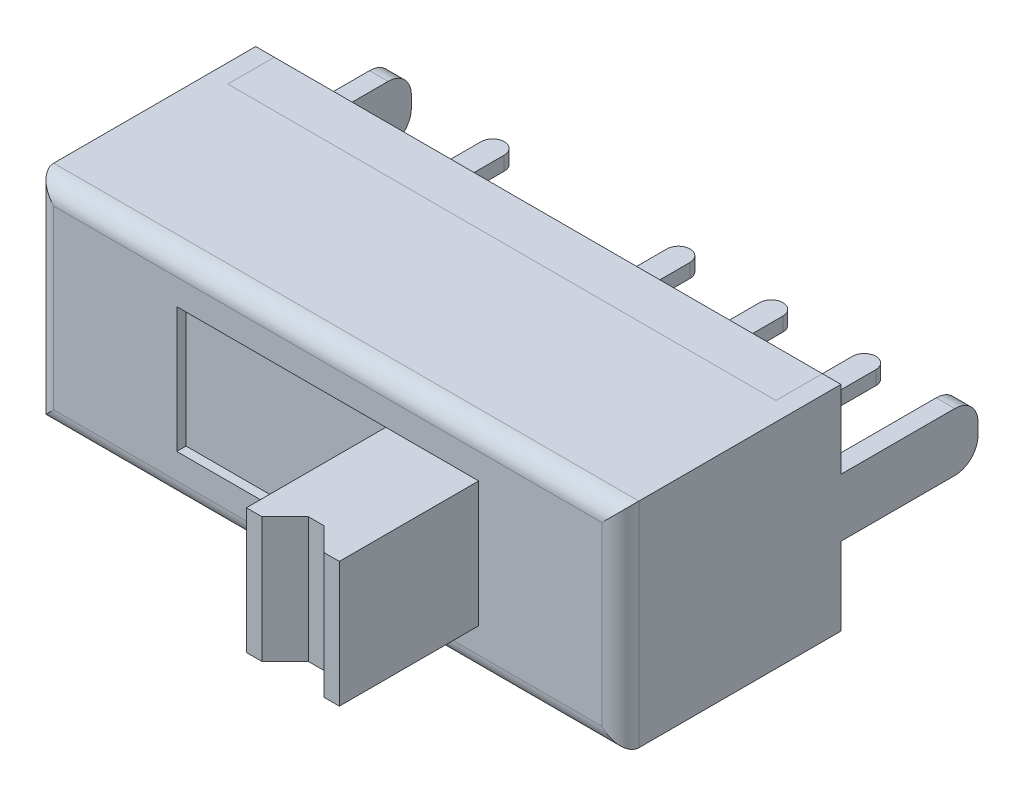
from build123d import *

# Parameters (mm, degrees)
SKETCH1_W                         = 12.6
SKETCH1_H                         = 4.6
BOSS_EXTRUDE1_DEPTH               = 4.75
FILLET2_R                         = 0.4
SKETCH2_W                         = 6.5
SKETCH2_H                         = 2.7
CUT_EXTRUDE1_DEPTH                = 0.2
BOSS_EXTRUDE2_DEPTH               = 2.7
SKETCH8_W                         = 11.8
SKETCH8_H                         = 4.6
CUT_EXTRUDE2_DEPTH                = 1
SKETCH5_W                         = 0.4
SKETCH5_H                         = 1.25
BOSS_EXTRUDE3_DEPTH               = 2.95
FILLET3_R                         = 0.5
FILLET3_OF_MIRROR1_R              = 0.5
SKETCH10_W                        = 0.5
SKETCH10_H                        = 0.3
BOSS_EXTRUDE6_DEPTH               = 4.05
FILLET5_RADIUS                    = 0.25
FILLET5_LENGTH                    = 0.3
LPATTERN3_COUNT                   = 3
LPATTERN3_PITCH                   = 2
FILLET5_OF_LPATTERN3_2_RADIUS     = 0.25
FILLET5_OF_LPATTERN3_2_LENGTH     = 0.3
FILLET5_OF_LPATTERN3_3_RADIUS     = 0.25
FILLET5_OF_LPATTERN3_3_LENGTH     = 0.3
LPATTERN3_COL_COUNT               = 2
LPATTERN3_COL_PITCH               = 4
FILLET5_OF_LPATTERN3_COL_2_RADIUS = 0.25
FILLET5_OF_LPATTERN3_COL_2_LENGTH = 0.3
SKETCH9_W                         = 11.8
SKETCH9_H                         = 4.6
BOSS_EXTRUDE7_DEPTH               = 1


with BuildPart() as part:
    # Sketch1 → Boss-Extrude1 (new body)
    with BuildSketch(Plane.XY):
        Rectangle(SKETCH1_W, SKETCH1_H)
    extrude(amount=BOSS_EXTRUDE1_DEPTH)

    # Fillet2
    fillet2_edges = [part.edges().sort_by_distance(p)[0] for p in [
        (-6.3, 0, 4.75),
        (0, -2.3, 4.75),
        (6.3, 0, 4.75),
        (0, 2.3, 4.75),
    ]]
    fillet(fillet2_edges, radius=FILLET2_R)

    # Sketch2 → Cut-Extrude1 (cut)
    with BuildSketch(Plane.XY.offset(4.75)):
        Rectangle(SKETCH2_W, SKETCH2_H)
    extrude(amount=-CUT_EXTRUDE1_DEPTH, mode=Mode.SUBTRACT)

    # Sketch4 → Boss-Extrude2 (add)
    with BuildSketch(Plane(origin=(0, -1.35, 0), x_dir=(1, 0, 0), z_dir=(0, 1, 0))):
        Polygon((3.25, -4.55), (3.25, -7.75), (2.916666667, -7.75), (2.416666667, -7.25), (2.083333333, -7.25), (1.583333333, -7.75), (1.25, -7.75), (1.25, -4.55), align=None)
    extrude(amount=BOSS_EXTRUDE2_DEPTH)

    # Sketch8 → Cut-Extrude2 (cut)
    with BuildSketch(Plane(origin=(0, 0, 0), x_dir=(-1, 0, 0), z_dir=(0, 0, -1))):
        Rectangle(SKETCH8_W, SKETCH8_H)
    extrude(amount=-CUT_EXTRUDE2_DEPTH, mode=Mode.SUBTRACT)

    # Sketch5 → Boss-Extrude3 (add)
    with BuildSketch(Plane(origin=(0, 0, 0), x_dir=(-1, 0, 0), z_dir=(0, 0, -1))):
        with Locations((-6.1, 0)):
            Rectangle(SKETCH5_W, SKETCH5_H)
    boss_extrude3 = extrude(amount=BOSS_EXTRUDE3_DEPTH)

    # Fillet3
    fillet3_edges = [part.edges().sort_by_distance(p)[0] for p in [
        (6.1, 0.625, -2.95),
        (6.1, -0.625, -2.95),
    ]]
    fillet(fillet3_edges, radius=FILLET3_R)

    # Mirror1: Boss-Extrude3 across plane
    add(boss_extrude3.mirror(Plane(origin=(0, 0, 0), x_dir=(0, 0, 1), z_dir=(1, 0, 0))))

    # Fillet3 of Mirror1
    fillet3_of_mirror1_edges = [part.edges().sort_by_distance(p)[0] for p in [
        (-6.1, 0.625, -2.95),
        (-6.1, -0.625, -2.95),
    ]]
    fillet(fillet3_of_mirror1_edges, radius=FILLET3_OF_MIRROR1_R)

    # Sketch10 → Boss-Extrude6 (add)
    with BuildSketch(Plane(origin=(0, 0, 1), x_dir=(-1, 0, 0), z_dir=(0, 0, -1))):
        Rectangle(SKETCH10_W, SKETCH10_H)
    boss_extrude6 = extrude(amount=BOSS_EXTRUDE6_DEPTH)

    # Fillet5: full round fillet: the end face becomes a half cylinder, R = half its width
    fillet5_face = Plane((0, 0, -3.05), x_dir=(0, -1, 0), z_dir=(0, 0, -1))  # on the end face: x along it, z out of the body
    fillet5_slab = fillet5_face.offset(-FILLET5_RADIUS / 2) * Box(FILLET5_LENGTH, 2 * FILLET5_RADIUS, FILLET5_RADIUS, mode=Mode.PRIVATE)  # the body's end, R deep
    fillet5_round = Plane((0, 0, -2.8), x_dir=(0, 0, -1), z_dir=(0, -1, 0)) * Cylinder(FILLET5_RADIUS, FILLET5_LENGTH, mode=Mode.PRIVATE)  # its axis R under the face
    add(fillet5_slab - fillet5_round, mode=Mode.SUBTRACT)

    # LPattern3: Boss-Extrude6 ×3
    with Locations(*[(i * LPATTERN3_PITCH, 0, 0) for i in range(1, LPATTERN3_COUNT)]):
        add(boss_extrude6)

    # Fillet5 of LPattern3 2: full round fillet: the end face becomes a half cylinder, R = half its width
    fillet5_of_lpattern3_2_face = Plane((2, 0, -3.05), x_dir=(0, -1, 0), z_dir=(0, 0, -1))  # on the end face: x along it, z out of the body
    fillet5_of_lpattern3_2_slab = fillet5_of_lpattern3_2_face.offset(-FILLET5_OF_LPATTERN3_2_RADIUS / 2) * Box(FILLET5_OF_LPATTERN3_2_LENGTH, 2 * FILLET5_OF_LPATTERN3_2_RADIUS, FILLET5_OF_LPATTERN3_2_RADIUS, mode=Mode.PRIVATE)  # the body's end, R deep
    fillet5_of_lpattern3_2_round = Plane((2, 0, -2.8), x_dir=(0, 0, -1), z_dir=(0, -1, 0)) * Cylinder(FILLET5_OF_LPATTERN3_2_RADIUS, FILLET5_OF_LPATTERN3_2_LENGTH, mode=Mode.PRIVATE)  # its axis R under the face
    add(fillet5_of_lpattern3_2_slab - fillet5_of_lpattern3_2_round, mode=Mode.SUBTRACT)

    # Fillet5 of LPattern3 3: full round fillet: the end face becomes a half cylinder, R = half its width
    fillet5_of_lpattern3_3_face = Plane((4, 0, -3.05), x_dir=(0, -1, 0), z_dir=(0, 0, -1))  # on the end face: x along it, z out of the body
    fillet5_of_lpattern3_3_slab = fillet5_of_lpattern3_3_face.offset(-FILLET5_OF_LPATTERN3_3_RADIUS / 2) * Box(FILLET5_OF_LPATTERN3_3_LENGTH, 2 * FILLET5_OF_LPATTERN3_3_RADIUS, FILLET5_OF_LPATTERN3_3_RADIUS, mode=Mode.PRIVATE)  # the body's end, R deep
    fillet5_of_lpattern3_3_round = Plane((4, 0, -2.8), x_dir=(0, 0, -1), z_dir=(0, -1, 0)) * Cylinder(FILLET5_OF_LPATTERN3_3_RADIUS, FILLET5_OF_LPATTERN3_3_LENGTH, mode=Mode.PRIVATE)  # its axis R under the face
    add(fillet5_of_lpattern3_3_slab - fillet5_of_lpattern3_3_round, mode=Mode.SUBTRACT)

    # LPattern3 col: Boss-Extrude6 ×2
    with Locations(*[(-i * LPATTERN3_COL_PITCH, 0, 0) for i in range(1, LPATTERN3_COL_COUNT)]):
        add(boss_extrude6)

    # Fillet5 of LPattern3 col 2: full round fillet: the end face becomes a half cylinder, R = half its width
    fillet5_of_lpattern3_col_2_face = Plane((-4, 0, -3.05), x_dir=(0, -1, 0), z_dir=(0, 0, -1))  # on the end face: x along it, z out of the body
    fillet5_of_lpattern3_col_2_slab = fillet5_of_lpattern3_col_2_face.offset(-FILLET5_OF_LPATTERN3_COL_2_RADIUS / 2) * Box(FILLET5_OF_LPATTERN3_COL_2_LENGTH, 2 * FILLET5_OF_LPATTERN3_COL_2_RADIUS, FILLET5_OF_LPATTERN3_COL_2_RADIUS, mode=Mode.PRIVATE)  # the body's end, R deep
    fillet5_of_lpattern3_col_2_round = Plane((-4, 0, -2.8), x_dir=(0, 0, -1), z_dir=(0, -1, 0)) * Cylinder(FILLET5_OF_LPATTERN3_COL_2_RADIUS, FILLET5_OF_LPATTERN3_COL_2_LENGTH, mode=Mode.PRIVATE)  # its axis R under the face
    add(fillet5_of_lpattern3_col_2_slab - fillet5_of_lpattern3_col_2_round, mode=Mode.SUBTRACT)


with BuildPart() as body_2:
    # Sketch9 → Boss-Extrude7 (new body)
    with BuildSketch(Plane(origin=(0, 0, 1), x_dir=(-1, 0, 0), z_dir=(0, 0, -1))):
        Rectangle(SKETCH9_W, SKETCH9_H)
    extrude(amount=BOSS_EXTRUDE7_DEPTH)


solid = Compound([part.part, body_2.part])
